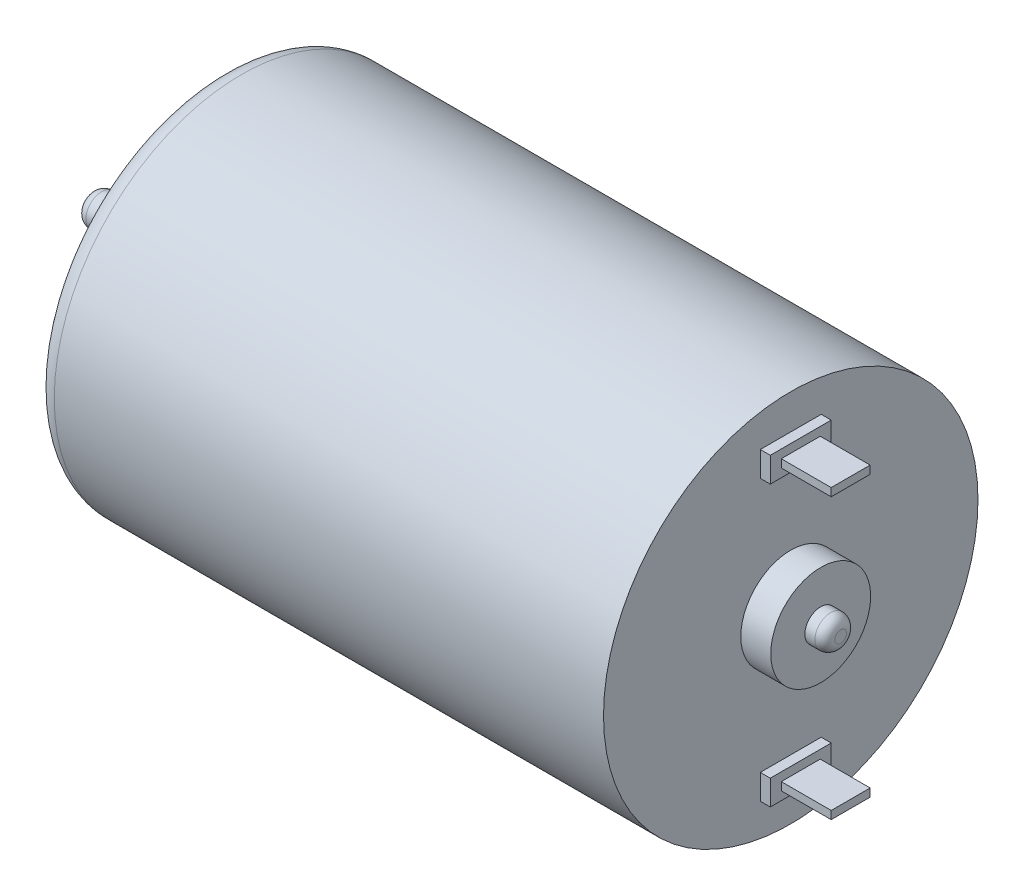
from build123d import *

# Parameters (mm, degrees)
VERRUNDUNG1_R                   = 1
VERRUNDUNG2_R                   = 2
FASE1_SIZE                      = 0.5
SKIZZE5_W                       = 6.1
SKIZZE5_H                       = 2.5
AUFSATZ_LINEAR_AUSTRAGEN1_DEPTH = 1
SKIZZE6_W                       = 3.9
SKIZZE6_H                       = 0.8
AUFSATZ_LINEAR_AUSTRAGEN2_DEPTH = 5


with BuildPart() as part:
    # Skizze3 → Rotation1 (revolve)
    with BuildSketch(Plane.XY, mode=Mode.PRIVATE) as rotation1_sk:
        Polygon((66.5, 1.5875), (66.5, 0), (0, 0), (-8.5, 0), (-8.5, 1.5875), (0, 1.5875), (64.5, 1.5875), align=None)
    revolve(rotation1_sk.sketch.rotate(Axis((0, 0, 0), (1, 0, 0)), 90), axis=Axis((0, 0, 0), (1, 0, 0)))

    # Verrundung1
    verrundung1_edges = [part.edges().sort_by_distance(p)[0] for p in [
        (-8.5, 0, -1.5875),
        (66.5, 0, -1.5875),
    ]]
    fillet(verrundung1_edges, radius=VERRUNDUNG1_R)


with BuildPart() as body_2:
    # Skizze4 → Rotation2 (revolve)
    with BuildSketch(Plane.XY, mode=Mode.PRIVATE) as rotation2_sk:
        Polygon((64.5, 1.5875), (0, 1.5875), (0, 6.5), (4.5, 6.5), (4.5, 18.75), (61.5, 18.75), (61.5, 5), (64.5, 5), align=None)
    revolve(rotation2_sk.sketch.rotate(Axis((0, 0, 0), (1, 0, 0)), 90), axis=Axis((0, 0, 0), (1, 0, 0)))

    # Skizze8 → M3 Gewindebohrung1 (revolve, cut)
    with BuildSketch(Plane(origin=(4.5, 12.5, 0), x_dir=(0, 0, 1), z_dir=(0, 1, 0))):
        Polygon((0, 0), (0, 9.251075774), (1.25, 8.5), (1.25, 0), align=None)
    m3_gewindebohrung1 = revolve(axis=Axis((-1.85, 12.5, 0), (1, 0, 0)), mode=Mode.SUBTRACT)

    # Verrundung2
    verrundung2_edges = [body_2.edges().sort_by_distance(p)[0] for p in [
        (4.5, 0, -18.75),
    ]]
    fillet(verrundung2_edges, radius=VERRUNDUNG2_R)

    # Fase1
    fase1_edges = [body_2.edges().sort_by_distance(p)[0] for p in [
        (0, 0, -6.5),
    ]]
    chamfer(fase1_edges, length=FASE1_SIZE)

    # Spiegeln1: M3 Gewindebohrung1 across plane
    add(m3_gewindebohrung1.mirror(Plane.ZX), mode=Mode.SUBTRACT)


with BuildPart() as body_3:
    # Skizze5 → Aufsatz-Linear austragen1 (new body)
    with BuildSketch(Plane(origin=(61.5, 0, 0), x_dir=(0, 0, -1), z_dir=(1, 0, 0))):
        with Locations((0, 14)):
            Rectangle(SKIZZE5_W, SKIZZE5_H)
    extrude(amount=AUFSATZ_LINEAR_AUSTRAGEN1_DEPTH)


with BuildPart() as body_4:
    # Skizze6 → Aufsatz-Linear austragen2 (new body)
    with BuildSketch(Plane(origin=(62.5, 0, 0), x_dir=(0, 0, -1), z_dir=(1, 0, 0))):
        with Locations((0, 14)):
            Rectangle(SKIZZE6_W, SKIZZE6_H)
    extrude(amount=AUFSATZ_LINEAR_AUSTRAGEN2_DEPTH)


with BuildPart() as body_5:
    # Spiegeln5: mirrored copy
    add(body_3.part.mirror(Plane.ZX))


with BuildPart() as body_6:
    # Spiegeln5 2: mirrored copy
    add(body_4.part.mirror(Plane.ZX))


solid = Compound([part.part, body_2.part, body_3.part, body_4.part, body_5.part, body_6.part])
